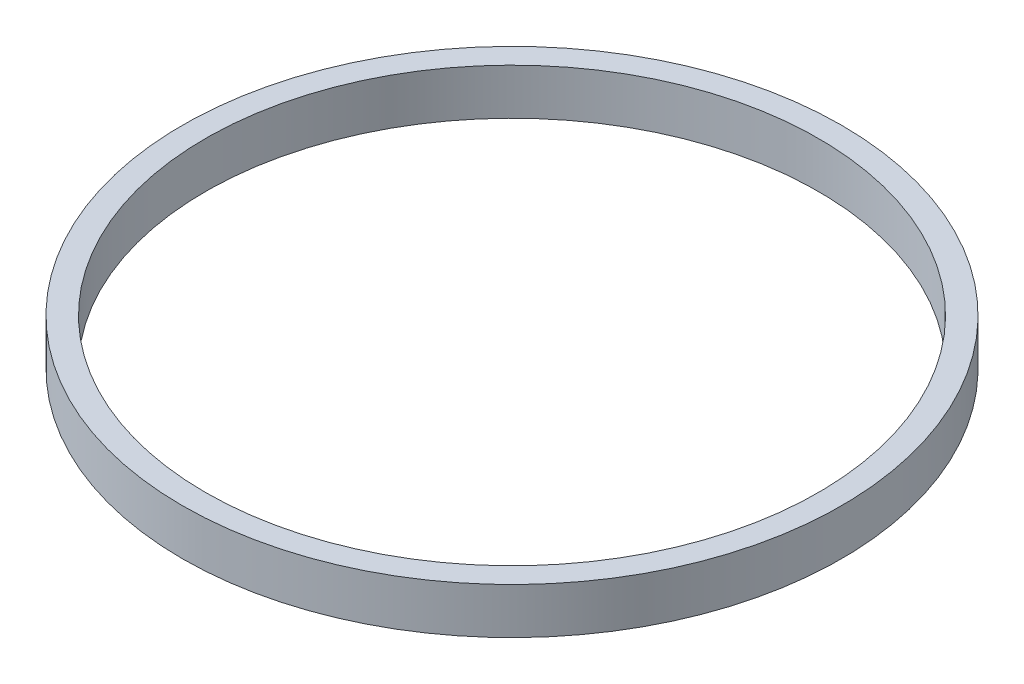
from build123d import *

# Parameters (mm, degrees)
SKETCH_1_R      = 21.5
SKETCH_1_R_2    = 20
EXTRUDE_1_DEPTH = 3


with BuildPart() as part:
    # Эскиз1 → Бобышка-Вытянуть1 (new body)
    with BuildSketch(Plane(origin=(0, 0, 0), x_dir=(1, 0, 0), z_dir=(0, 1, 0))):
        with Locations(Location((0, 0, 0), (0, 0, 270))):
            Circle(SKETCH_1_R)
        with Locations(Location((0, 0, 0), (0, 0, 270))):
            Circle(SKETCH_1_R_2, mode=Mode.SUBTRACT)
    extrude(amount=EXTRUDE_1_DEPTH)


solid = part.part
